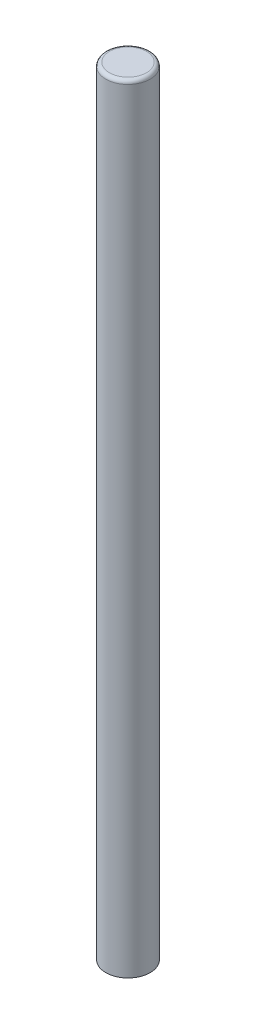
from build123d import *

# Parameters (mm, degrees)
SKETCH1_R           = 3
BOSS_EXTRUDE1_DEPTH = 105
FILLET1_R           = 0.5


with BuildPart() as part:
    # Sketch1 → Boss-Extrude1 (new body)
    with BuildSketch(Plane(origin=(0, 0, 0), x_dir=(1, 0, 0), z_dir=(0, 1, 0))):
        with Locations(Location((0, 0, 0), (0, 0, 270))):
            Circle(SKETCH1_R)
    extrude(amount=BOSS_EXTRUDE1_DEPTH)

    # Fillet1
    fillet1_edges = [part.edges().sort_by_distance(p)[0] for p in [
        (0, 105, -3),
    ]]
    fillet(fillet1_edges, radius=FILLET1_R)


solid = part.part
